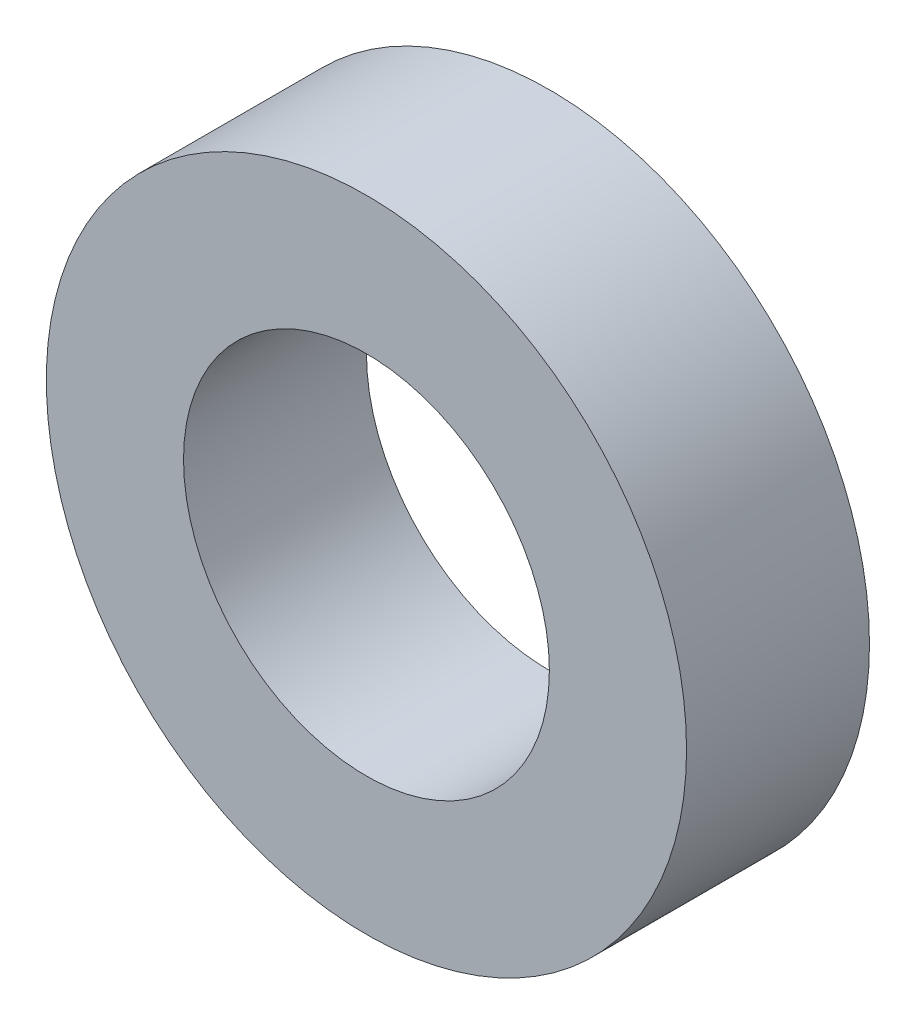
from build123d import *

# Parameters (mm, degrees)
SKETCH1_R           = 3.5
SKETCH1_R_2         = 2
BOSS_EXTRUDE1_DEPTH = 1


with BuildPart() as part:
    # Sketch1 → Boss-Extrude1 (new, symmetric)
    with BuildSketch(Plane.XY):
        Circle(SKETCH1_R)
        Circle(SKETCH1_R_2, mode=Mode.SUBTRACT)
    extrude(amount=BOSS_EXTRUDE1_DEPTH, both=True)


solid = part.part
